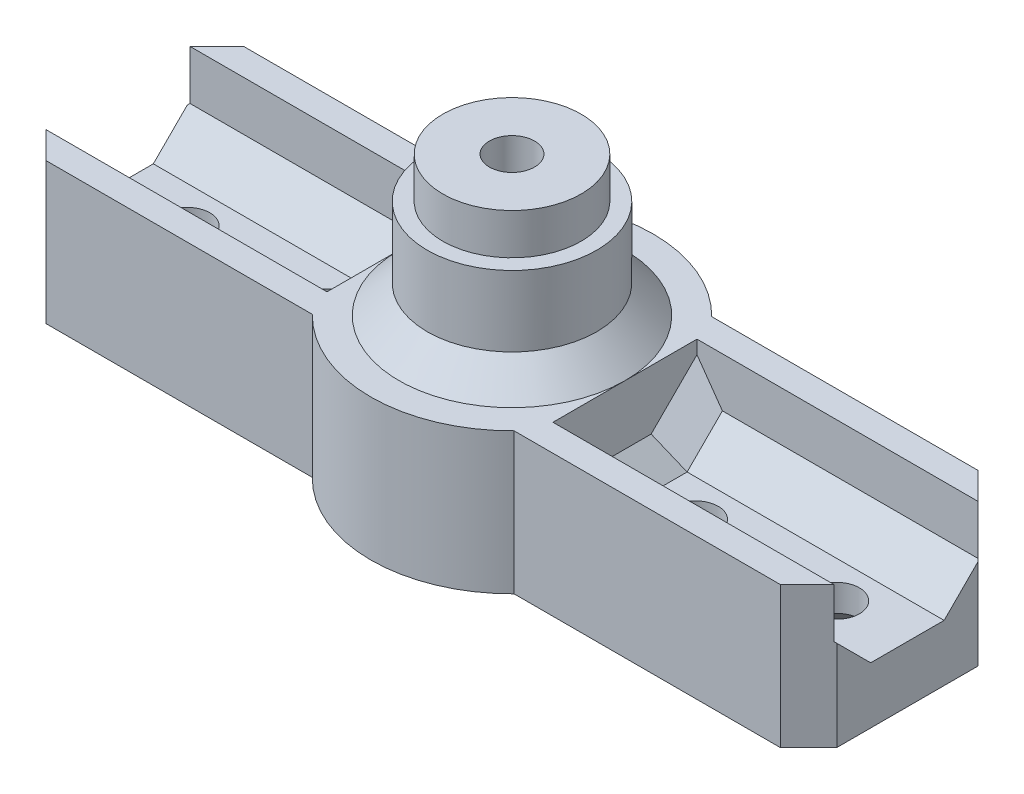
from build123d import *

# Parameters (mm, degrees)
BOSS_EXTRU_1_DEPTH           = 10
ENL_V_MAT_EXTRU_1_DEPTH      = 20
CHANFREIN1_SIZE              = 2.5
CHANFREIN2_SIZE              = 1.8
CHANFREIN1_OF_SYM_TRIE1_SIZE = 2.5
CHANFREIN2_OF_SYM_TRIE1_SIZE = 1.8
ESQUISSE5_R                  = 1.6000000000000016
ESQUISSE5_R_2                = 1.6000000000000019
ENL_V_MAT_EXTRU_4_DEPTH      = 7
CHANFREIN4_SIZE              = 2.1
CHANFREIN5_SIZE              = 2
ESQUISSE6_R                  = 6
BOSS_EXTRU_2_DEPTH           = 7
ESQUISSE7_R                  = 4.9
BOSS_EXTRU_3_DEPTH           = 2.9
ESQUISSE8_R                  = 1.6
ENL_V_MAT_EXTRU_5_DEPTH      = 36.777227393972275
CHANFREIN6_SIZE              = 2.1
CHANFREIN7_SIZE              = 2


with BuildPart() as part:
    # Esquisse1 → Boss.-Extru.1 (new body)
    with BuildSketch(Plane(origin=(0, 0, 0), x_dir=(1, 0, 0), z_dir=(0, 1, 0))):
        with BuildLine():
            Line((7.1414284285428495, 7), (27.999999999999996, 7))
            Line((27.999999999999996, 7), (27.999999999999996, -7))
            Line((27.999999999999996, -7), (7.1414284285428495, -7))
            ThreePointArc((7.1414284285428495, -7), (6.1e-16, -10), (-7.1414284285428495, -7))
            Line((-7.1414284285428495, -7), (-28.000000000000004, -7))
            Line((-28.000000000000004, -7), (-28.000000000000004, 7))
            Line((-28.000000000000004, 7), (-7.1414284285428495, 7))
            ThreePointArc((-7.1414284285428495, 7), (6.1e-16, 10), (7.1414284285428495, 7))
        make_face()
    extrude(amount=BOSS_EXTRU_1_DEPTH)

    # Esquisse2 → Enlèv. mat.-Extru.1 (cut)
    with BuildSketch(Plane.ZY.offset(28.000000000000004)):
        Polygon((-5.1000000000000005, 10), (5.099999999999999, 10), (5.099999999999999, 3.999999999999999), (-5.1000000000000005, 4), align=None)
    enl_v_mat_extru_1 = extrude(amount=-ENL_V_MAT_EXTRU_1_DEPTH, mode=Mode.SUBTRACT)

    # Chanfrein1
    chanfrein1_edges = [part.edges().sort_by_distance(p)[0] for p in [
        (-18.000000000000004, 4, -5.1000000000000005),
        (-18.000000000000004, 3.999999999999999, 5.099999999999999),
    ]]
    chamfer(chanfrein1_edges, length=CHANFREIN1_SIZE)

    # Chanfrein2
    chanfrein2_edges = [part.edges().sort_by_distance(p)[0] for p in [
        (-8.000000000000004, 3.9999999999999996, -8.9e-16),
        (-8.000000000000005, 5.250000000000001, -3.8500000000000005),
        (-8.000000000000004, 5.25, 3.849999999999998),
    ]]
    chamfer(chanfrein2_edges, length=CHANFREIN2_SIZE)

    # Symétrie1: Enlèv. mat.-Extru.1 across plane
    add(enl_v_mat_extru_1.mirror(Plane(origin=(0, 0, 0), x_dir=(0, 0, 1), z_dir=(1, 0, 0))), mode=Mode.SUBTRACT)

    # Chanfrein1 of Symétrie1
    chanfrein1_of_sym_trie1_edges = [part.edges().sort_by_distance(p)[0] for p in [
        (18.000000000000004, 4, -5.1000000000000005),
        (18.000000000000004, 3.999999999999999, 5.099999999999999),
    ]]
    chamfer(chanfrein1_of_sym_trie1_edges, length=CHANFREIN1_OF_SYM_TRIE1_SIZE)

    # Chanfrein2 of Symétrie1
    chanfrein2_of_sym_trie1_edges = [part.edges().sort_by_distance(p)[0] for p in [
        (8.000000000000004, 3.9999999999999996, -8.9e-16),
        (8.000000000000005, 5.250000000000001, -3.8500000000000005),
        (8.000000000000004, 5.25, 3.849999999999998),
    ]]
    chamfer(chanfrein2_of_sym_trie1_edges, length=CHANFREIN2_OF_SYM_TRIE1_SIZE)

    # Esquisse5 → Enlèv. mat.-Extru.4 (cut)
    with BuildSketch(Plane.XZ):
        with Locations(Location((-23.000000000000004, 0, 0), (0, 0, 270))):
            Circle(ESQUISSE5_R)
        with Locations(Location((-13.000000000000004, 0, 0), (0, 0, 270))):
            Circle(ESQUISSE5_R_2)
        with Locations(Location((12.999999999999996, 0, 0), (0, 0, 270))):
            Circle(ESQUISSE5_R_2)
        with Locations(Location((22.999999999999993, 0, 0), (0, 0, 270))):
            Circle(ESQUISSE5_R)
    extrude(amount=-ENL_V_MAT_EXTRU_4_DEPTH, mode=Mode.SUBTRACT)

    # Chanfrein4
    chanfrein4_edges = [part.edges().sort_by_distance(p)[0] for p in [
        (-23.000000000000004, 0, 1.6000000000000016),
        (-13.000000000000004, 0, 1.6000000000000019),
        (12.999999999999996, 0, 1.6000000000000019),
        (22.999999999999993, 0, 1.6000000000000016),
    ]]
    chamfer(chanfrein4_edges, length=CHANFREIN4_SIZE)

    # Chanfrein5
    chanfrein5_edges = [part.edges().sort_by_distance(p)[0] for p in [
        (27.999999999999996, 5, -7),
        (27.999999999999996, 5, 7),
        (-28.000000000000004, 5, -7),
        (-28.000000000000004, 5, 7),
    ]]
    chamfer(chanfrein5_edges, length=CHANFREIN5_SIZE)

    # Esquisse6 → Boss.-Extru.2 (add)
    with BuildSketch(Plane(origin=(0, 10, 0), x_dir=(1, 0, 0), z_dir=(0, 1, 0))):
        with Locations(Location((0, 0, 0), (0, 0, 270))):
            Circle(ESQUISSE6_R)
    extrude(amount=BOSS_EXTRU_2_DEPTH)

    # Esquisse7 → Boss.-Extru.3 (add)
    with BuildSketch(Plane(origin=(0, 17, 0), x_dir=(1, 0, 0), z_dir=(0, 1, 0))):
        with Locations(Location((0, 0, 0), (0, 0, 270))):
            Circle(ESQUISSE7_R)
    extrude(amount=BOSS_EXTRU_3_DEPTH)

    # Esquisse8 → Enlèv. mat.-Extru.5 (cut, through all)
    with BuildSketch(Plane(origin=(0, 19.900000000000002, 0), x_dir=(1, 0, 0), z_dir=(0, 1, 0))):
        with Locations(Location((0, 0, 0), (0, 0, 270))):
            Circle(ESQUISSE8_R)
    extrude(amount=-ENL_V_MAT_EXTRU_5_DEPTH, mode=Mode.SUBTRACT)

    # Chanfrein6
    chanfrein6_edges = [part.edges().sort_by_distance(p)[0] for p in [
        (4.9e-16, 0, -1.6),
    ]]
    chamfer(chanfrein6_edges, length=CHANFREIN6_SIZE)

    # Chanfrein7
    chanfrein7_edges = [part.edges().sort_by_distance(p)[0] for p in [
        (1.84e-15, 10, -6),
    ]]
    chamfer(chanfrein7_edges, length=CHANFREIN7_SIZE)


solid = part.part
